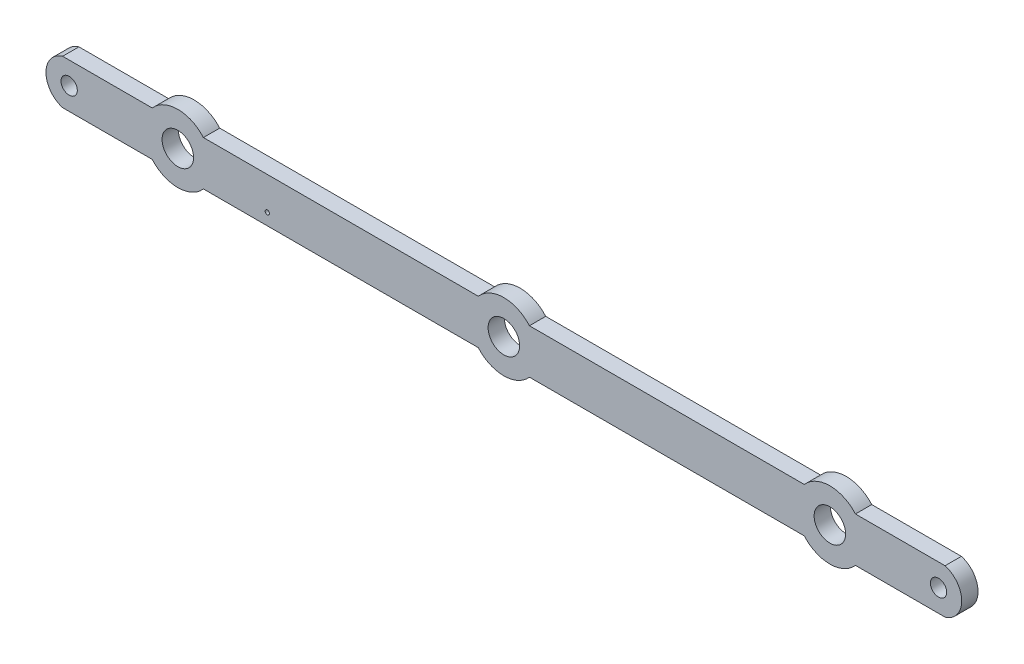
from build123d import *

# Parameters (mm, degrees)
SKETCH1_R           = 2.9
SKETCH1_R_2         = 1.5
SKETCH1_R_3         = 0.390297289
BOSS_EXTRUDE1_DEPTH = 3


with BuildPart() as part:
    # Sketch1 → Boss-Extrude1 (new body)
    with BuildSketch(Plane.XY):
        with BuildLine():
            Line((-81.201730293, 4.097407022), (-64.706257079, 4.097407022))
            ThreePointArc((-64.706257079, 4.097407022), (-60, 6.24), (-55.293742921, 4.097407022))
            Line((-55.293742921, 4.097407022), (-4.706257079, 4.097407022))
            ThreePointArc((-4.706257079, 4.097407022), (0, 6.24), (4.706257079, 4.097407022))
            Line((4.706257079, 4.097407022), (55.293742921, 4.097407022))
            ThreePointArc((55.293742921, 4.097407022), (60, 6.24), (64.706257079, 4.097407022))
            Line((64.706257079, 4.097407022), (81.201730293, 4.097407022))
            ThreePointArc((81.201730293, 4.097407022), (84.27, 0), (81.201730293, -4.097407022))
            Line((81.201730293, -4.097407022), (64.706257079, -4.097407022))
            ThreePointArc((64.706257079, -4.097407022), (60, -6.24), (55.293742921, -4.097407022))
            Line((55.293742921, -4.097407022), (4.706257079, -4.097407022))
            ThreePointArc((4.706257079, -4.097407022), (0, -6.24), (-4.706257079, -4.097407022))
            Line((-4.706257079, -4.097407022), (-55.293742921, -4.097407022))
            ThreePointArc((-55.293742921, -4.097407022), (-60, -6.24), (-64.706257079, -4.097407022))
            Line((-64.706257079, -4.097407022), (-81.201730293, -4.097407022))
            ThreePointArc((-81.201730293, -4.097407022), (-84.27, 0), (-81.201730293, 4.097407022))
        make_face()
        with Locations((-60, 0)):
            Circle(SKETCH1_R, mode=Mode.SUBTRACT)
        Circle(SKETCH1_R, mode=Mode.SUBTRACT)
        with Locations((60, 0)):
            Circle(SKETCH1_R, mode=Mode.SUBTRACT)
        with Locations((80, 0)):
            Circle(SKETCH1_R_2, mode=Mode.SUBTRACT)
        with Locations((-80, 0)):
            Circle(SKETCH1_R_2, mode=Mode.SUBTRACT)
        with Locations((-43.533553558, -1.94889321)):
            Circle(SKETCH1_R_3, mode=Mode.SUBTRACT)
    extrude(amount=BOSS_EXTRUDE1_DEPTH)


solid = part.part
